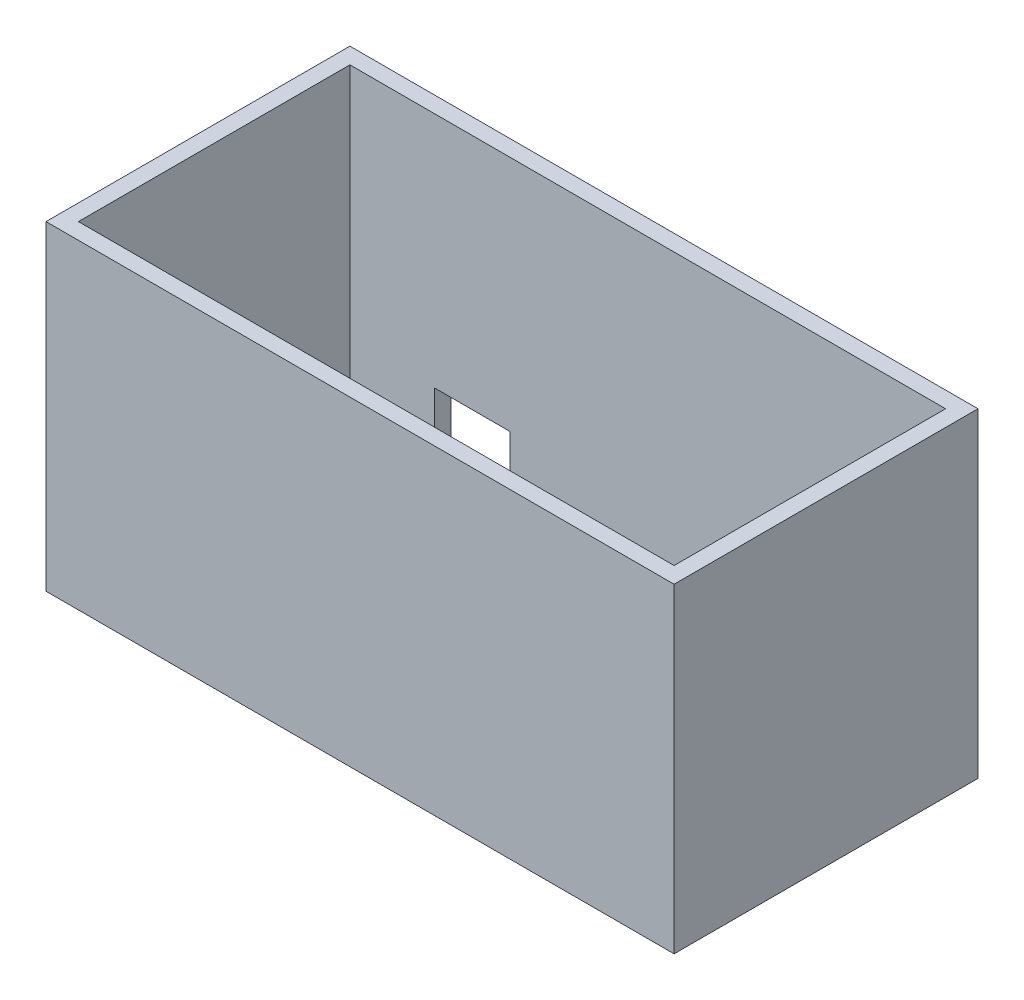
from build123d import *

# Parameters (mm, degrees)
SKETCH1_W           = 196.85
SKETCH1_H           = 95.25
BOSS_EXTRUDE1_DEPTH = 5.08
SKETCH2_W           = 196.85
SKETCH2_H           = 95.25
SKETCH2_W_2         = 186.69
SKETCH2_H_2         = 85.09
BOSS_EXTRUDE2_DEPTH = 95.25
SKETCH3_W           = 23.641725961
SKETCH3_H           = 20.24411265
CUT_EXTRUDE2_DEPTH  = 7.62


with BuildPart() as part:
    # Sketch1 → Boss-Extrude1 (new body)
    with BuildSketch(Plane(origin=(0, 0, 0), x_dir=(1, 0, 0), z_dir=(0, 1, 0))):
        Rectangle(SKETCH1_W, SKETCH1_H)
    extrude(amount=BOSS_EXTRUDE1_DEPTH)

    # Sketch2 → Boss-Extrude2 (add)
    with BuildSketch(Plane(origin=(0, 5.08, 0), x_dir=(1, 0, 0), z_dir=(0, 1, 0))):
        Rectangle(SKETCH2_W, SKETCH2_H)
        Rectangle(SKETCH2_W_2, SKETCH2_H_2, mode=Mode.SUBTRACT)
    extrude(amount=BOSS_EXTRUDE2_DEPTH)

    # Sketch3 → Cut-Extrude2 (cut)
    with BuildSketch(Plane(origin=(0, 0, -47.625), x_dir=(-1, 0, 0), z_dir=(0, 0, -1))):
        with Locations((54.966211615, 15.778514315)):
            Rectangle(SKETCH3_W, SKETCH3_H)
    extrude(amount=-CUT_EXTRUDE2_DEPTH, mode=Mode.SUBTRACT)


solid = part.part
